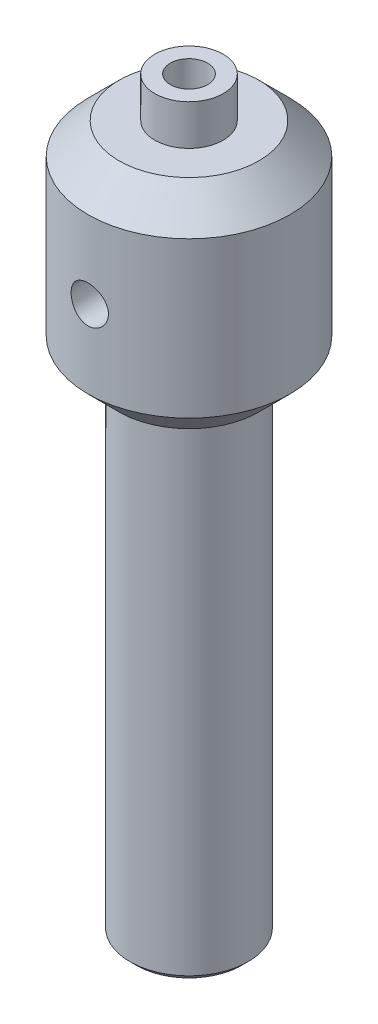
from build123d import *

# Parameters (mm, degrees)
CHAMFER1_SIZE           = 10
CUT_EXTRUDE1_DEPTH      = 245.361412666
CUT_EXTRUDE1_DEPTH_BACK = 245.361412666
SKETCH2_R               = 6
HOLE1_D                 = 12
HOLE1_DEPTH             = 23
CHAMFER2_SIZE           = 2


with BuildPart() as part:
    # Sketch1 → Revolve1 (revolve)
    with BuildSketch(Plane.XY, mode=Mode.PRIVATE) as revolve1_sk:
        Polygon((0, 0), (19, 0), (19, 157), (32.5, 157), (32.5, 227), (11, 227), (11, 240), (0, 240), align=None)
    revolve(revolve1_sk.sketch.rotate(Axis((0, 240, 0), (0, -1, 0)), 180), axis=Axis((0, 240, 0), (0, -1, 0)))

    # Chamfer1
    chamfer1_edges = [part.edges().sort_by_distance(p)[0] for p in [
        (32.5, 227, 0),
        (32.5, 157, 0),
    ]]
    chamfer(chamfer1_edges, length=CHAMFER1_SIZE)

    # Sketch2 → Cut-Extrude1 (cut, two sides: drawn at the far end of the back side and taken through both)
    with BuildSketch(Plane.XY.offset(-CUT_EXTRUDE1_DEPTH_BACK)):
        with Locations((0, 192)):
            Circle(SKETCH2_R)
    extrude(amount=CUT_EXTRUDE1_DEPTH + CUT_EXTRUDE1_DEPTH_BACK, mode=Mode.SUBTRACT)

    # Hole1
    with Locations(Plane(origin=(0, 240, 0), x_dir=(1, 0, 0), z_dir=(0, 1, 0))):
        with Locations((0, 0)):
            Hole(HOLE1_D / 2, depth=HOLE1_DEPTH)

    # Chamfer2
    chamfer2_edges = [part.edges().sort_by_distance(p)[0] for p in [
        (19, 0, 0),
    ]]
    chamfer(chamfer2_edges, length=CHAMFER2_SIZE)


solid = part.part
